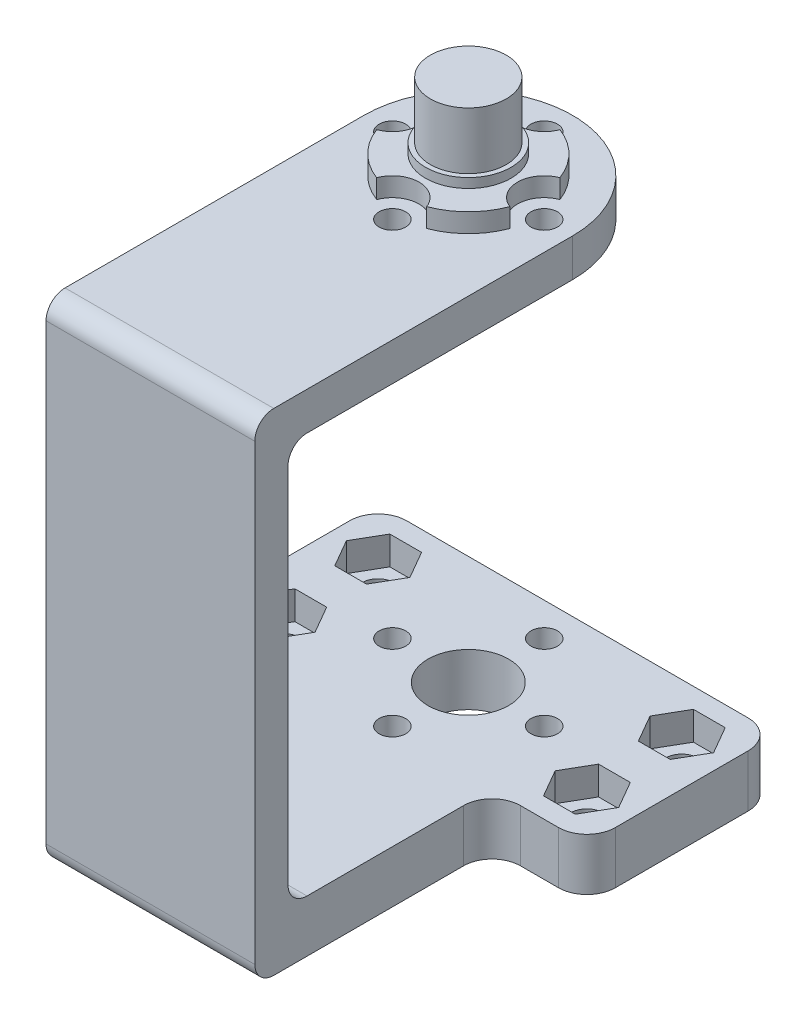
from build123d import *

# Parameters (mm, degrees)
SKETCH1_R           = 11
SKETCH1_R_2         = 4.25
BOSS_EXTRUDE1_DEPTH = 4
SKETCH2_R           = 1.4
CUT_EXTRUDE1_DEPTH  = 17.062378404
SKETCH3_R           = 7.5
BOSS_EXTRUDE2_DEPTH = 2
SKETCH4_R           = 2.811136831
CUT_EXTRUDE2_DEPTH  = 2
SKETCH5_R           = 4.5
BOSS_EXTRUDE3_DEPTH = 7
CUT_EXTRUDE3_START  = -6
SKETCH6_R           = 4.5
SKETCH6_R_2         = 4
CUT_EXTRUDE3_DEPTH  = 6
BOSS_EXTRUDE4_DEPTH = 4
SKETCH13_W          = 22
SKETCH13_H          = 3.5
BOSS_EXTRUDE5_DEPTH = 46.25
SKETCH14_W          = 22
SKETCH14_H          = 5.5
BOSS_EXTRUDE6_DEPTH = 45
CUT_EXTRUDE6_START  = -30
SKETCH16_R          = 4.25
SKETCH16_R_2        = 1.4
CUT_EXTRUDE6_DEPTH  = 30
SKETCH17_W          = 10
SKETCH17_H          = 5.5
BOSS_EXTRUDE7_DEPTH = 20
SKETCH18_R          = 1.7
CUT_EXTRUDE7_DEPTH  = 30
FILLET2_R           = 3
FILLET3_R           = 2
SKETCH19_R          = 2.5
CUT_EXTRUDE8_DEPTH  = 1.5
CUT_EXTRUDE9_DEPTH  = 3


with BuildPart() as part:
    # Sketch1 → Boss-Extrude1 (new body)
    with BuildSketch(Plane(origin=(0, 0, 0), x_dir=(1, 0, 0), z_dir=(0, 1, 0))):
        with Locations(Location((0, 0, 0), (0, 0, 270))):
            Circle(SKETCH1_R)
        with Locations(Location((0, 0, 0), (0, 0, 270))):
            Circle(SKETCH1_R_2, mode=Mode.SUBTRACT)
    extrude(amount=BOSS_EXTRUDE1_DEPTH)

    # Sketch2 → Cut-Extrude1 (cut, through all)
    with BuildSketch(Plane(origin=(0, 4, 0), x_dir=(1, 0, 0), z_dir=(0, 1, 0))):
        with Locations(Location((0, 8, 0), (0, 0, 270))):
            Circle(SKETCH2_R)
        with Locations(Location((8, 0, 0), (0, 0, 270))):
            Circle(SKETCH2_R)
        with Locations(Location((0, -8, 0), (0, 0, 270))):
            Circle(SKETCH2_R)
        with Locations(Location((-8, 0, 0), (0, 0, 270))):
            Circle(SKETCH2_R)
    extrude(amount=-CUT_EXTRUDE1_DEPTH, mode=Mode.SUBTRACT)

    # Sketch3 → Boss-Extrude2 (add)
    with BuildSketch(Plane(origin=(0, 4, 0), x_dir=(1, 0, 0), z_dir=(0, 1, 0))):
        with Locations(Location((0, 0, 0), (0, 0, 80.315835906))):
            Circle(SKETCH3_R)
    extrude(amount=BOSS_EXTRUDE2_DEPTH)

    # Sketch4 → Cut-Extrude2 (cut)
    with BuildSketch(Plane(origin=(0, 6, 0), x_dir=(1, 0, 0), z_dir=(0, 1, 0))):
        with Locations((8, 0)):
            Circle(SKETCH4_R)
        with Locations((0, -8)):
            Circle(SKETCH4_R)
        with Locations((-8, 0)):
            Circle(SKETCH4_R)
        with Locations((0, 8)):
            Circle(SKETCH4_R)
    extrude(amount=-CUT_EXTRUDE2_DEPTH, mode=Mode.SUBTRACT)

    # Sketch5 → Boss-Extrude3 (add)
    with BuildSketch(Plane(origin=(0, 6, 0), x_dir=(1, 0, 0), z_dir=(0, 1, 0))):
        with Locations(Location((0, 0, 0), (0, 0, 270))):
            Circle(SKETCH5_R)
    extrude(amount=BOSS_EXTRUDE3_DEPTH)

    # Sketch6 → Cut-Extrude3 (cut)
    with BuildSketch(Plane(origin=(0, 13, 0), x_dir=(1, 0, 0), z_dir=(0, 1, 0)).offset(CUT_EXTRUDE3_START)):
        with Locations(Location((0, 0, 0), (0, 0, 270))):
            Circle(SKETCH6_R)
        with Locations(Location((0, 0, 0), (0, 0, 270))):
            Circle(SKETCH6_R_2, mode=Mode.SUBTRACT)
    extrude(amount=CUT_EXTRUDE3_DEPTH, mode=Mode.SUBTRACT)

    # Sketch8 → Boss-Extrude4 (add)
    with BuildSketch(Plane.XZ):
        with BuildLine():
            Line((11, 30), (-11, 30))
            Line((-11, 30), (-11, 0))
            ThreePointArc((-11, 0), (0, 11), (11, 0))
            Line((11, 0), (11, 30))
        make_face()
    extrude(amount=-BOSS_EXTRUDE4_DEPTH)

    # Sketch13 → Boss-Extrude5 (add)
    with BuildSketch(Plane(origin=(0, 4, 0), x_dir=(1, 0, 0), z_dir=(0, 1, 0))):
        with Locations((0, -31.75)):
            Rectangle(SKETCH13_W, SKETCH13_H)
    extrude(amount=-BOSS_EXTRUDE5_DEPTH)

    # Sketch14 → Boss-Extrude6 (add)
    with BuildSketch(Plane.XY.offset(33.5)):
        with Locations((0, -45)):
            Rectangle(SKETCH14_W, SKETCH14_H)
    extrude(amount=-BOSS_EXTRUDE6_DEPTH)

    # Sketch16 → Cut-Extrude6 (cut)
    with BuildSketch(Plane.XZ.offset(47.75).offset(CUT_EXTRUDE6_START)):
        with Locations(Location((0, 0, 0), (0, 0, 90))):
            Circle(SKETCH16_R)
        with Locations(Location((-8, 0, 0), (0, 0, 90))):
            Circle(SKETCH16_R_2)
        with Locations(Location((0, -8, 0), (0, 0, 90))):
            Circle(SKETCH16_R_2)
        with Locations(Location((8, 0, 0), (0, 0, 90))):
            Circle(SKETCH16_R_2)
        with Locations(Location((0, 8, 0), (0, 0, 90))):
            Circle(SKETCH16_R_2)
    extrude(amount=CUT_EXTRUDE6_DEPTH, mode=Mode.SUBTRACT)

    # Sketch17 → Boss-Extrude7 (add)
    with BuildSketch(Plane(origin=(0, 0, -11.5), x_dir=(-1, 0, 0), z_dir=(0, 0, -1))):
        with Locations((-16, -45)):
            Rectangle(SKETCH17_W, SKETCH17_H)
        with Locations((16, -45)):
            Rectangle(SKETCH17_W, SKETCH17_H)
    extrude(amount=-BOSS_EXTRUDE7_DEPTH)

    # Sketch18 → Cut-Extrude7 (cut)
    with BuildSketch(Plane(origin=(0, -47.75, 0), x_dir=(-1, 0, 0), z_dir=(0, -1, 0))):
        with Locations(Location((16, -3.5, 0), (0, 0, 90))):
            Circle(SKETCH18_R)
        with Locations(Location((16, 6.5, 0), (0, 0, 90))):
            Circle(SKETCH18_R)
        with Locations(Location((-16, 6.5, 0), (0, 0, 270))):
            Circle(SKETCH18_R)
        with Locations(Location((-16, -3.5, 0), (0, 0, 270))):
            Circle(SKETCH18_R)
    extrude(amount=-CUT_EXTRUDE7_DEPTH, mode=Mode.SUBTRACT)

    # Fillet2
    fillet2_edges = [part.edges().sort_by_distance(p)[0] for p in [
        (21, -45, 8.5),
        (11, -45, 8.5),
        (21, -45, -11.5),
        (-21, -45, 8.5),
        (-11, -45, 8.5),
        (-21, -45, -11.5),
    ]]
    fillet(fillet2_edges, radius=FILLET2_R)

    # Fillet3
    fillet3_edges = [part.edges().sort_by_distance(p)[0] for p in [
        (0, 0, 30),
        (0, -42.25, 30),
        (0, 4, 33.5),
        (0, -47.75, 33.5),
    ]]
    fillet(fillet3_edges, radius=FILLET3_R)

    # Sketch19 → Cut-Extrude8 (cut)
    with BuildSketch(Plane.XZ.offset(47.75)):
        with Locations((-8, 0)):
            Circle(SKETCH19_R)
        with Locations((0, 8)):
            Circle(SKETCH19_R)
        with Locations((8, 0)):
            Circle(SKETCH19_R)
        with Locations((0, -8)):
            Circle(SKETCH19_R)
    extrude(amount=-CUT_EXTRUDE8_DEPTH, mode=Mode.SUBTRACT)

    # Sketch20 → Cut-Extrude9 (cut)
    with BuildSketch(Plane(origin=(0, -42.25, 0), x_dir=(1, 0, 0), z_dir=(0, 1, 0))):
        Polygon((17.674315781, 3.6), (19.348631561, 6.5), (17.674315781, 9.4), (14.325684219, 9.4), (12.651368439, 6.5), (14.325684219, 3.6), align=None)
        Polygon((-14.325684219, 3.6), (-12.651368439, 6.5), (-14.325684219, 9.4), (-17.674315781, 9.4), (-19.348631561, 6.5), (-17.674315781, 3.6), align=None)
        Polygon((17.674315781, -6.4), (19.348631561, -3.5), (17.674315781, -0.6), (14.325684219, -0.6), (12.651368439, -3.5), (14.325684219, -6.4), align=None)
        Polygon((-14.325684219, -6.4), (-12.651368439, -3.5), (-14.325684219, -0.6), (-17.674315781, -0.6), (-19.348631561, -3.5), (-17.674315781, -6.4), align=None)
    extrude(amount=-CUT_EXTRUDE9_DEPTH, mode=Mode.SUBTRACT)


solid = part.part
